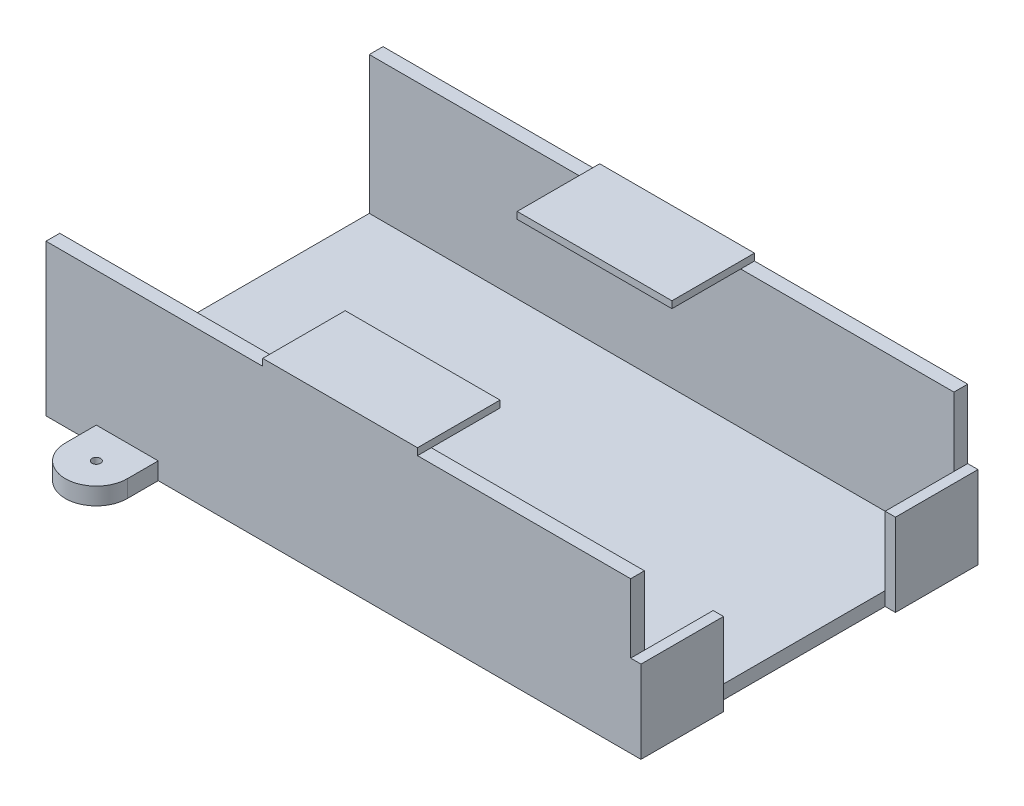
from build123d import *

# Parameters (mm, degrees)
SKETCH1_W           = 215.9
SKETCH1_H           = 114.3
BOSS_EXTRUDE1_DEPTH = 5.08
SKETCH2_W           = 215.9
SKETCH2_H           = 55.88
BOSS_EXTRUDE2_DEPTH = 5.08
SKETCH4_W           = 30.48
SKETCH4_H           = 30.48
BOSS_EXTRUDE3_DEPTH = 3.81
SKETCH5_W           = 57.15
SKETCH5_H           = 30.48
SKETCH5_W_2         = 57.169606557
BOSS_EXTRUDE4_DEPTH = 2.54
BOSS_EXTRUDE6_DEPTH = 15.875
SKETCH14_R          = 1.5875
CUT_EXTRUDE1_DEPTH  = 236.930487909
BOSS_EXTRUDE7_DEPTH = 15.875
SKETCH21_R          = 1.5875
CUT_EXTRUDE6_DEPTH  = 236.930487909
CUT_EXTRUDE10_START = -9.525
CUT_EXTRUDE10_DEPTH = 9.525
CUT_EXTRUDE11_START = -8.89
CUT_EXTRUDE11_DEPTH = 8.89
CUT_EXTRUDE12_START = -8.89
CUT_EXTRUDE12_DEPTH = 8.89


with BuildPart() as part:
    # Sketch1 → Boss-Extrude1 (new body)
    with BuildSketch(Plane(origin=(0, 0, 0), x_dir=(1, 0, 0), z_dir=(0, 1, 0))):
        with Locations((-107.95, 0)):
            Rectangle(SKETCH1_W, SKETCH1_H)
    extrude(amount=BOSS_EXTRUDE1_DEPTH)

    # Sketch2 → Boss-Extrude2 (add)
    with BuildSketch(Plane.XY.offset(57.15)):
        with Locations((-107.95, 27.94)):
            Rectangle(SKETCH2_W, SKETCH2_H)
    boss_extrude2 = extrude(amount=BOSS_EXTRUDE2_DEPTH)

    # Mirror1: Boss-Extrude2 across plane
    add(boss_extrude2.mirror(Plane.XY))

    # Sketch4 → Boss-Extrude3 (add)
    with BuildSketch(Plane(origin=(0, 0, 0), x_dir=(0, 0, -1), z_dir=(1, 0, 0))):
        with Locations((-46.99, 15.24)):
            Rectangle(SKETCH4_W, SKETCH4_H)
        with Locations((46.99, 15.24)):
            Rectangle(SKETCH4_W, SKETCH4_H)
    extrude(amount=BOSS_EXTRUDE3_DEPTH)

    # Sketch5 → Boss-Extrude4 (add)
    with BuildSketch(Plane(origin=(0, 55.88, 0), x_dir=(1, 0, 0), z_dir=(0, 1, 0))):
        with Locations((-107.309206557, 46.99)):
            Rectangle(SKETCH5_W, SKETCH5_H)
        with Locations((-107.299403278, -46.99)):
            Rectangle(SKETCH5_W_2, SKETCH5_H)
    extrude(amount=BOSS_EXTRUDE4_DEPTH)

    # Sketch12 → Boss-Extrude6 (add)
    with BuildSketch(Plane(origin=(0, 0, 0), x_dir=(1, 0, 0), z_dir=(0, 1, 0))):
        with BuildLine():
            Line((-62.23, 62.23), (-62.23, 73.66))
            ThreePointArc((-62.23, 73.66), (-50.8, 85.09), (-39.37, 73.66))
            Line((-39.37, 73.66), (-39.37, 62.23))
            Line((-39.37, 62.23), (-62.23, 62.23))
        make_face()
    extrude(amount=BOSS_EXTRUDE6_DEPTH)

    # Sketch14 → Cut-Extrude1 (cut, through all)
    with BuildSketch(Plane(origin=(0, 15.875, 0), x_dir=(1, 0, 0), z_dir=(0, 1, 0))):
        with Locations(Location((-50.8, 73.66, 0), (0, 0, 270))):
            Circle(SKETCH14_R)
    extrude(amount=-CUT_EXTRUDE1_DEPTH, mode=Mode.SUBTRACT)

    # Sketch20 → Boss-Extrude7 (add)
    with BuildSketch(Plane(origin=(0, 0, 0), x_dir=(1, 0, 0), z_dir=(0, 1, 0))):
        with BuildLine():
            Line((-197.317867116, 62.23), (-197.317867116, 73.66))
            ThreePointArc((-197.317867116, 73.66), (-185.887867116, 85.09), (-174.457867116, 73.66))
            Line((-174.457867116, 73.66), (-174.457867116, 62.23))
            Line((-174.457867116, 62.23), (-197.317867116, 62.23))
        make_face()
    boss_extrude7 = extrude(amount=BOSS_EXTRUDE7_DEPTH)

    # Sketch21 → Cut-Extrude6 (cut, through all)
    with BuildSketch(Plane(origin=(0, 15.875, 0), x_dir=(1, 0, 0), z_dir=(0, 1, 0))):
        with Locations(Location((-185.887867116, 73.66, 0), (0, 0, 270))):
            Circle(SKETCH21_R)
    cut_extrude6 = extrude(amount=-CUT_EXTRUDE6_DEPTH, mode=Mode.SUBTRACT)

    # Mirror4: Boss-Extrude7 across plane
    add(boss_extrude7.mirror(Plane.XY))

    # Mirror5: Cut-Extrude6 across plane
    add(cut_extrude6.mirror(Plane.XY), mode=Mode.SUBTRACT)

    # Sketch25 → Cut-Extrude10 (cut)
    with BuildSketch(Plane(origin=(0, 15.875, 0), x_dir=(1, 0, 0), z_dir=(0, 1, 0)).offset(CUT_EXTRUDE10_START)):
        with BuildLine():
            Line((-197.317867116, -62.23), (-197.317867116, -73.66))
            ThreePointArc((-197.317867116, -73.66), (-185.887867116, -85.09), (-174.457867116, -73.66))
            Line((-174.457867116, -73.66), (-174.457867116, -62.23))
            Line((-174.457867116, -62.23), (-197.317867116, -62.23))
        make_face()
    extrude(amount=CUT_EXTRUDE10_DEPTH, mode=Mode.SUBTRACT)

    # Sketch26 → Cut-Extrude11 (cut)
    with BuildSketch(Plane(origin=(0, 15.875, 0), x_dir=(1, 0, 0), z_dir=(0, 1, 0)).offset(CUT_EXTRUDE11_START)):
        with BuildLine():
            Line((-62.23, 62.23), (-39.37, 62.23))
            Line((-39.37, 62.23), (-39.37, 73.66))
            ThreePointArc((-39.37, 73.66), (-50.8, 85.09), (-62.23, 73.66))
            Line((-62.23, 73.66), (-62.23, 62.23))
        make_face()
    extrude(amount=CUT_EXTRUDE11_DEPTH, mode=Mode.SUBTRACT)

    # Sketch27 → Cut-Extrude12 (cut)
    with BuildSketch(Plane(origin=(0, 15.875, 0), x_dir=(1, 0, 0), z_dir=(0, 1, 0)).offset(CUT_EXTRUDE12_START)):
        with BuildLine():
            Line((-197.317867116, 62.23), (-174.457867116, 62.23))
            Line((-174.457867116, 62.23), (-174.457867116, 73.66))
            ThreePointArc((-174.457867116, 73.66), (-185.887867116, 85.09), (-197.317867116, 73.66))
            Line((-197.317867116, 73.66), (-197.317867116, 62.23))
        make_face()
    extrude(amount=CUT_EXTRUDE12_DEPTH, mode=Mode.SUBTRACT)


solid = part.part
